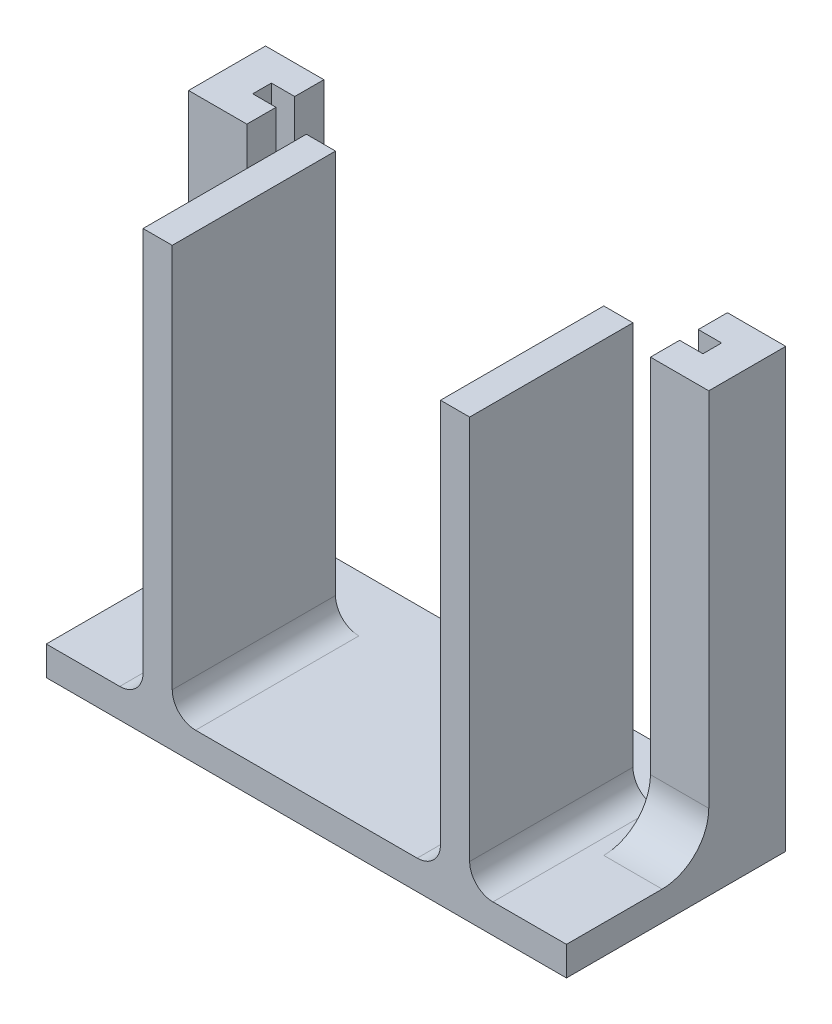
from build123d import *

# Parameters (mm, degrees)
BOSS_EXTRUDE1_DEPTH   = 35
BOSS_EXTRUDE1_2_DEPTH = 35
SKETCH1_W             = 2.5
SKETCH1_H             = 14
BOSS_EXTRUDE1_3_DEPTH = 35
BOSS_EXTRUDE1_4_DEPTH = 35
SKETCH2_W             = 44.6
SKETCH2_H             = 18.8
BOSS_EXTRUDE2_DEPTH   = 2.5
FILLET1_R             = 2
FILLET2_R             = 4


with BuildPart() as part:
    # Sketch1 → Boss-Extrude1 (new body)
    with BuildSketch(Plane(origin=(0, -19, 0), x_dir=(1, 0, 0), z_dir=(0, 1, 0))):
        Polygon((-19.3, 0.3), (-17.3, 0.3), (-17.3, 2.8), (-22.3, 2.8), (-22.3, -3.8), (-17.3, -3.8), (-17.3, -1.3), (-19.3, -1.3), align=None)
    extrude(amount=BOSS_EXTRUDE1_DEPTH)



with BuildPart() as body_2:
    # Sketch1 → Boss-Extrude1 2 (new body)
    with BuildSketch(Plane(origin=(0, -19, 0), x_dir=(1, 0, 0), z_dir=(0, 1, 0))):
        Polygon((19.3, -1.3), (19.3, 0.3), (17.3, 0.3), (17.3, 2.8), (22.3, 2.8), (22.3, -3.8), (17.3, -3.8), (17.3, -1.3), align=None)
    extrude(amount=BOSS_EXTRUDE1_2_DEPTH)


with BuildPart() as body_3:
    # Sketch1 → Boss-Extrude1 3 (new body)
    with BuildSketch(Plane(origin=(0, -19, 0), x_dir=(1, 0, 0), z_dir=(0, 1, 0))):
        with Locations((12.75, -9)):
            Rectangle(SKETCH1_W, SKETCH1_H)
    extrude(amount=BOSS_EXTRUDE1_3_DEPTH)


with BuildPart() as body_4:
    # Sketch1 → Boss-Extrude1 4 (new body)
    with BuildSketch(Plane(origin=(0, -19, 0), x_dir=(1, 0, 0), z_dir=(0, 1, 0))):
        with Locations((-12.75, -9)):
            Rectangle(SKETCH1_W, SKETCH1_H)
    extrude(amount=BOSS_EXTRUDE1_4_DEPTH)


with BuildPart() as part_1:
    add(part.part)

    add(body_2.part)  # Boss-Extrude2 merges body 2

    add(body_3.part)  # Boss-Extrude2 merges body 3

    add(body_4.part)  # Boss-Extrude2 merges body 4
    # Sketch2 → Boss-Extrude2 (add)
    with BuildSketch(Plane(origin=(0, -19, 0), x_dir=(1, 0, 0), z_dir=(0, 1, 0))):
        with Locations((0, -6.6)):
            Rectangle(SKETCH2_W, SKETCH2_H)
    extrude(amount=-BOSS_EXTRUDE2_DEPTH)

    # Fillet1
    fillet1_edges = [part_1.edges().sort_by_distance(p)[0] for p in [
        (11.5, -19, 9),
        (14, -19, 9),
        (-14, -19, 9),
        (-11.5, -19, 9),
    ]]
    fillet(fillet1_edges, radius=FILLET1_R)

    # Fillet2
    fillet2_edges = [part_1.edges().sort_by_distance(p)[0] for p in [
        (19.8, -19, 3.8),
        (-19.8, -19, 3.8),
    ]]
    fillet(fillet2_edges, radius=FILLET2_R)


solid = part_1.part
